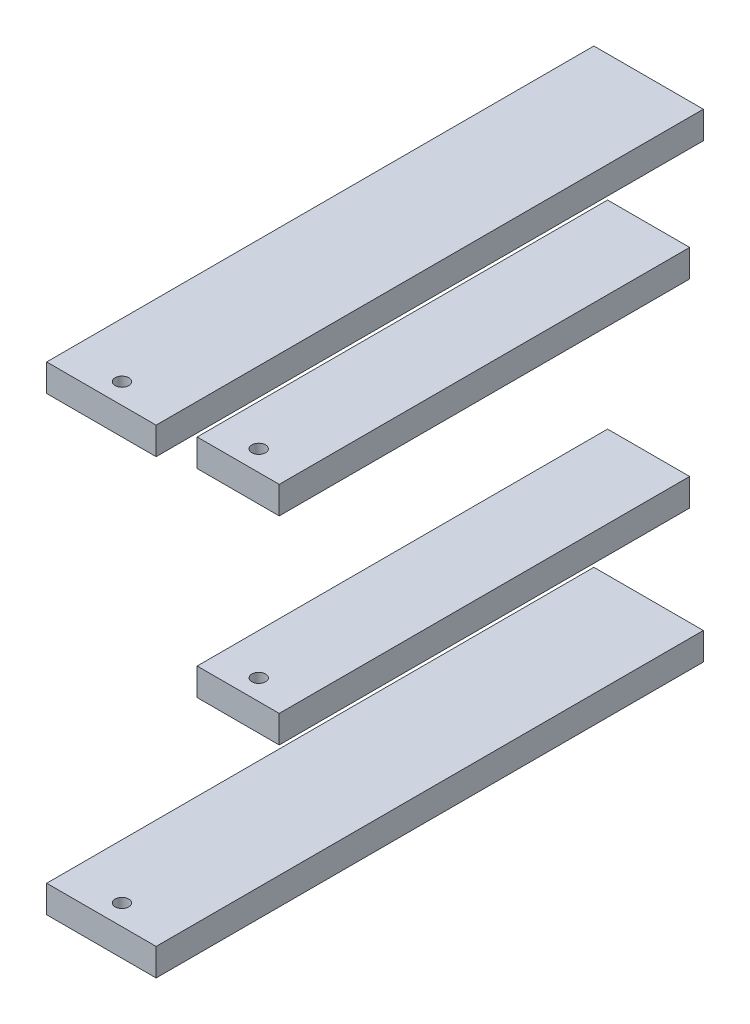
from build123d import *

# Parameters (mm, degrees)
SKETCH_1_W          = 80
SKETCH_1_H          = 20
EXTRUDE_1_DEPTH     = 400
EXTRUDE_1_2_DEPTH   = 400
SKETCH_3_R          = 5
CUT_EXTRUDE_1_DEPTH = 400
SKETCH_4_W          = 60
SKETCH_4_H          = 20
EXTRUDE_2_DEPTH     = 300
EXTRUDE_2_2_DEPTH   = 300
SKETCH_5_R          = 5
CUT_EXTRUDE_2_DEPTH = 300


with BuildPart() as part:
    # Эскиз1 → Бобышка-Вытянуть1 (new body)
    with BuildSketch(Plane.XY):
        with Locations((0, 165)):
            Rectangle(SKETCH_1_W, SKETCH_1_H)
    extrude(amount=EXTRUDE_1_DEPTH)


with BuildPart() as body_2:
    # Эскиз1 → Extrude 1 2 (new body)
    with BuildSketch(Plane.XY):
        with Locations((0, -165)):
            Rectangle(SKETCH_1_W, SKETCH_1_H)
    extrude(amount=EXTRUDE_1_2_DEPTH)


with BuildPart() as cut_extrude_1_tool:
    # Эскиз3 → Вырез-Вытянуть1 (new body)
    with BuildSketch(Plane.XZ.offset(175)):
        with Locations((0, 385)):
            Circle(SKETCH_3_R)
    extrude(amount=-CUT_EXTRUDE_1_DEPTH)


with BuildPart() as part_1:
    add(part.part)

    # Вырез-Вытянуть1: cut by cut_extrude_1_tool
    add(cut_extrude_1_tool.part, mode=Mode.SUBTRACT)


with BuildPart() as body_2_1:
    add(body_2.part)

    # Вырез-Вытянуть1: cut by cut_extrude_1_tool
    add(cut_extrude_1_tool.part, mode=Mode.SUBTRACT)


with BuildPart() as body_3:
    # Эскиз4 → Бобышка-Вытянуть2 (new body)
    with BuildSketch(Plane.XY):
        with Locations((0, -72.5)):
            Rectangle(SKETCH_4_W, SKETCH_4_H)
    extrude(amount=EXTRUDE_2_DEPTH)


with BuildPart() as body_4:
    # Эскиз4 → Extrude 2 2 (new body)
    with BuildSketch(Plane.XY):
        with Locations((0, 72.5)):
            Rectangle(SKETCH_4_W, SKETCH_4_H)
    extrude(amount=EXTRUDE_2_2_DEPTH)


with BuildPart() as cut_extrude_2_tool:
    # Эскиз5 → Вырез-Вытянуть2 (new body)
    with BuildSketch(Plane.XZ.offset(82.5)):
        with Locations(Location((0, 285, 0), (0, 0, 270))):
            Circle(SKETCH_5_R)
    extrude(amount=-CUT_EXTRUDE_2_DEPTH)


with BuildPart() as body_4_1:
    add(body_4.part)

    # Вырез-Вытянуть2: cut by cut_extrude_2_tool
    add(cut_extrude_2_tool.part, mode=Mode.SUBTRACT)


with BuildPart() as body_3_1:
    add(body_3.part)

    # Вырез-Вытянуть2: cut by cut_extrude_2_tool
    add(cut_extrude_2_tool.part, mode=Mode.SUBTRACT)


solid = Compound([part_1.part, body_2_1.part, body_4_1.part, body_3_1.part])
